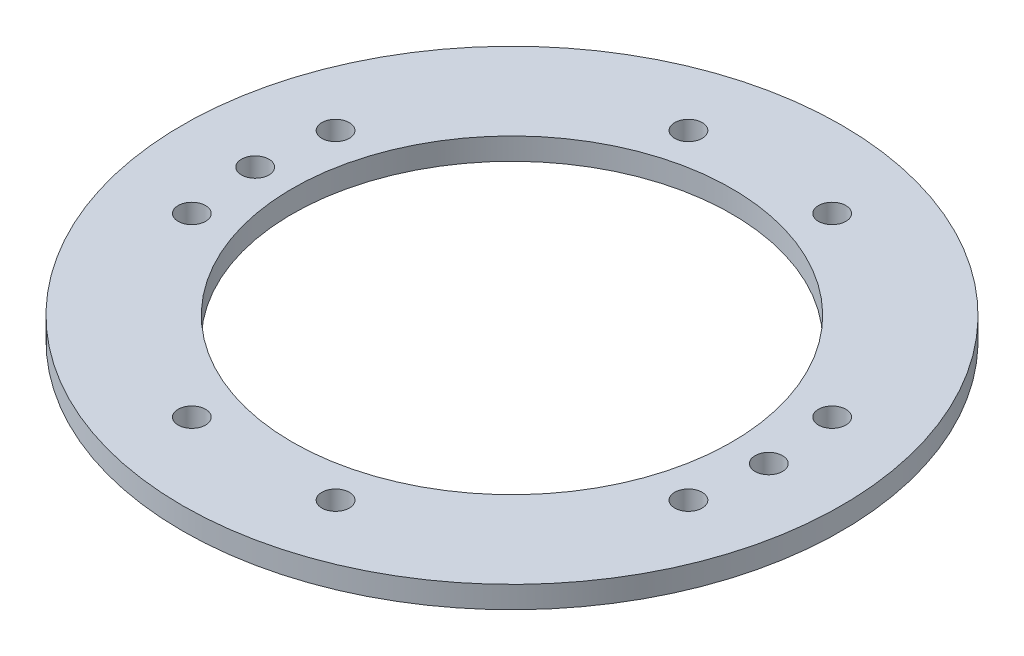
from build123d import *

# Parameters (mm, degrees)
SKETCH1_R           = 76.2
SKETCH1_R_2         = 50.8
SKETCH1_R_3         = 3.175
BOSS_EXTRUDE1_DEPTH = 5.08


with BuildPart() as part:
    # Sketch1 → Boss-Extrude1 (new body)
    with BuildSketch(Plane(origin=(0, 0, 0), x_dir=(1, 0, 0), z_dir=(0, 1, 0))):
        with Locations(Location((0, 0, 0), (0, 0, 270))):
            Circle(SKETCH1_R)
        with Locations(Location((0, 0, 0), (0, 0, 270))):
            Circle(SKETCH1_R_2, mode=Mode.SUBTRACT)
        with Locations(Location((-16.616808798, 57.412007925, 0), (0, 0, 270))):
            Circle(SKETCH1_R_3, mode=Mode.SUBTRACT)
        with Locations(Location((16.616808798, 57.412007925, 0), (0, 0, 270))):
            Circle(SKETCH1_R_3, mode=Mode.SUBTRACT)
        with Locations(Location((57.412007925, 16.616808798, 0), (0, 0, 270))):
            Circle(SKETCH1_R_3, mode=Mode.SUBTRACT)
        with Locations(Location((16.616808798, -57.412007925, 0), (0, 0, 270))):
            Circle(SKETCH1_R_3, mode=Mode.SUBTRACT)
        with Locations(Location((-57.412007925, -16.616808798, 0), (0, 0, 270))):
            Circle(SKETCH1_R_3, mode=Mode.SUBTRACT)
        with Locations(Location((57.412007925, -16.616808798, 0), (0, 0, 270))):
            Circle(SKETCH1_R_3, mode=Mode.SUBTRACT)
        with Locations(Location((-16.616808798, -57.412007925, 0), (0, 0, 270))):
            Circle(SKETCH1_R_3, mode=Mode.SUBTRACT)
        with Locations(Location((-57.412007925, 16.616808798, 0), (0, 0, 270))):
            Circle(SKETCH1_R_3, mode=Mode.SUBTRACT)
        with Locations(Location((-59.372417952, 0, 0), (0, 0, 270))):
            Circle(SKETCH1_R_3, mode=Mode.SUBTRACT)
        with Locations(Location((59.372417952, 0, 0), (0, 0, 270))):
            Circle(SKETCH1_R_3, mode=Mode.SUBTRACT)
    extrude(amount=BOSS_EXTRUDE1_DEPTH)


solid = part.part
